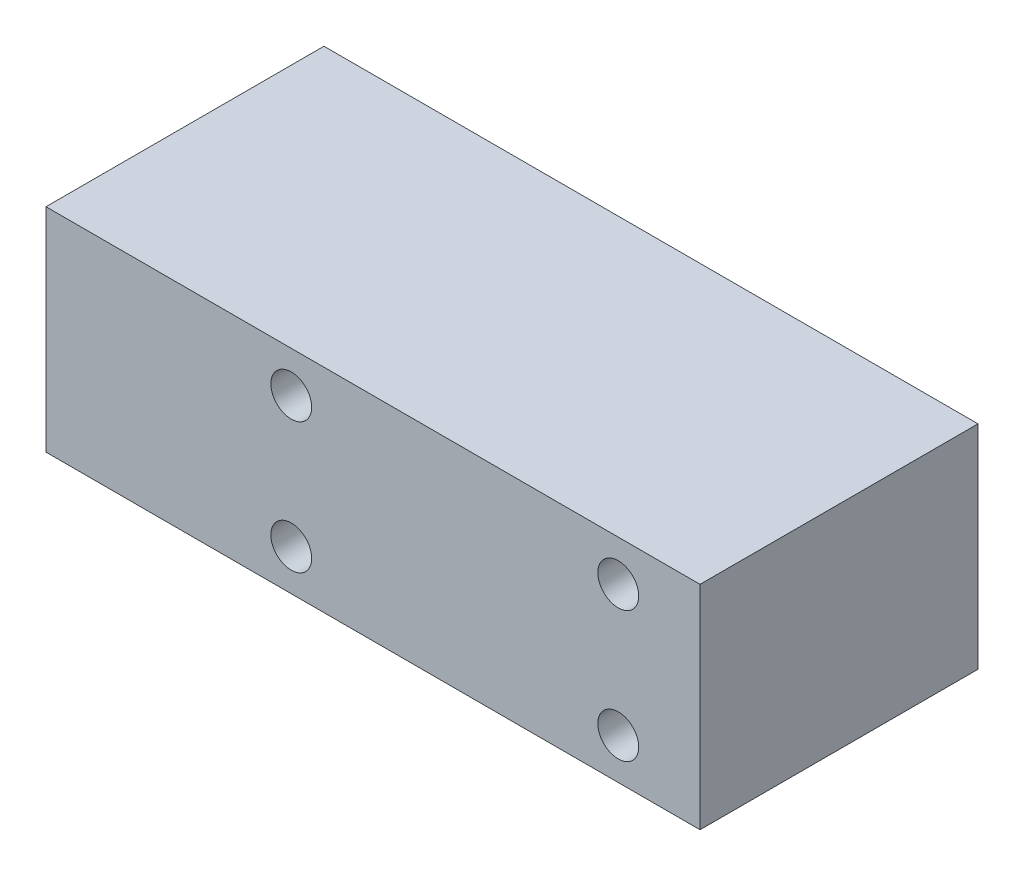
from build123d import *

# Parameters (mm, degrees)
SKETCH_1_W             = 80
SKETCH_1_H             = 26
EXTRUDE_1_DEPTH        = 34
HOLE_WIZARD_M6_1_D     = 5
HOLE_WIZARD_M6_1_DEPTH = 15
HOLE_WIZARD_M6_1_TIP   = 1.502151548
HOLE_WIZARD_M6_2_D     = 5
HOLE_WIZARD_M6_2_DEPTH = 15
HOLE_WIZARD_M6_2_TIP   = 1.502151548


with BuildPart() as part:
    # 草图1 → 凸台-拉伸1 (new body)
    with BuildSketch(Plane.XY):
        with Locations((40, 13)):
            Rectangle(SKETCH_1_W, SKETCH_1_H)
    extrude(amount=EXTRUDE_1_DEPTH)

    # M6 螺纹孔1
    with Locations(Plane.XY.offset(34)):
        with Locations((70, 21), (70, 5), (30, 21), (30, 5)):
            Hole(HOLE_WIZARD_M6_1_D / 2, depth=HOLE_WIZARD_M6_1_DEPTH)
            with Locations((0, 0, -(HOLE_WIZARD_M6_1_DEPTH + HOLE_WIZARD_M6_1_TIP / 2))):  # 118° drill point
                Cone(0, HOLE_WIZARD_M6_1_D / 2, HOLE_WIZARD_M6_1_TIP, mode=Mode.SUBTRACT)

    # M6 螺纹孔2
    with Locations(Plane(origin=(0, 0, 0), x_dir=(-1, 0, 0), z_dir=(0, 0, -1))):
        with Locations((-10, 5), (-10, 21), (-70, 21), (-70, 5)):
            Hole(HOLE_WIZARD_M6_2_D / 2, depth=HOLE_WIZARD_M6_2_DEPTH)
            with Locations((0, 0, -(HOLE_WIZARD_M6_2_DEPTH + HOLE_WIZARD_M6_2_TIP / 2))):  # 118° drill point
                Cone(0, HOLE_WIZARD_M6_2_D / 2, HOLE_WIZARD_M6_2_TIP, mode=Mode.SUBTRACT)


solid = part.part
